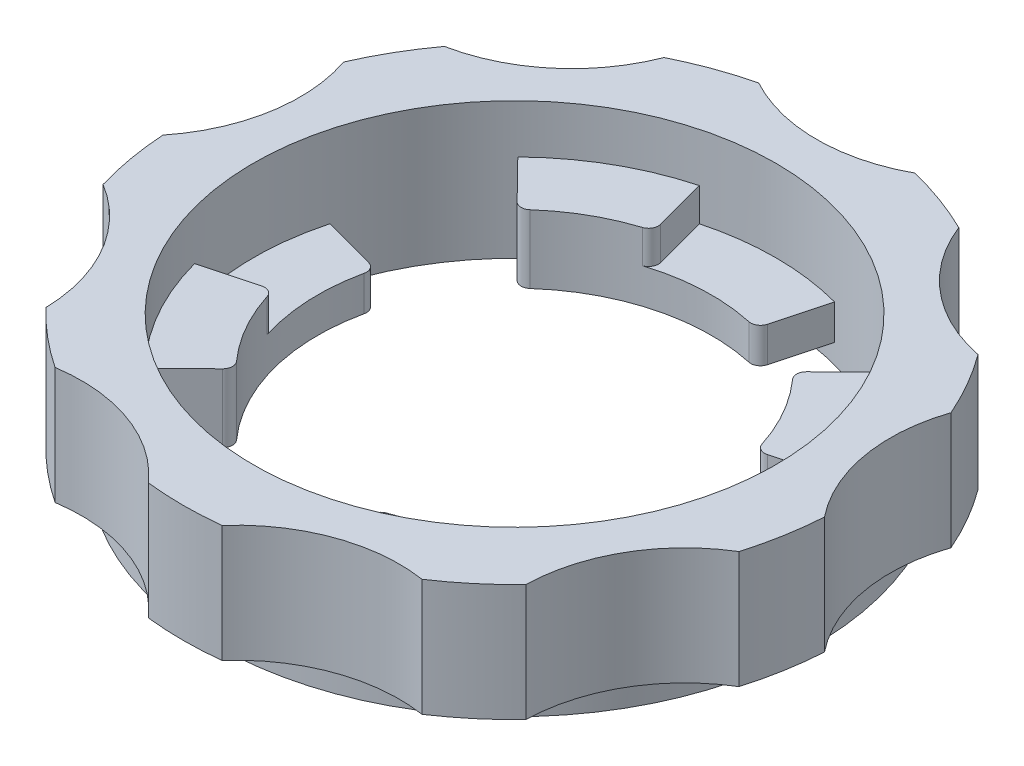
from build123d import *
from build123d.topology import SkipClean

# Parameters (mm, degrees)
EXTRUDE_1_DEPTH                  = 3
SKETCH_3_R                       = 15.4
EXTRUDE_2_DEPTH                  = 1
SKETCH_4_R                       = 13.4
CUT_EXTRUDE_1_DEPTH              = 68.538877693
EXTRUDE_3_DEPTH                  = 3.5
CUT_EXTRUDE_START                = -1.7
CUT_EXTRUDE_2_DEPTH              = 1.7
FILLET_1_R                       = 0.5
PATTERN_CIRCULAR_1_COUNT         = 4
FILLET_1_OF_PATTERN_CIRCULAR_1_R = 0.5
HOLE_WIZARD_M2_1_D               = 2.4
HOLE_WIZARD_M2_1_CBORE_D         = 5
HOLE_WIZARD_M2_1_CBORE_DEPTH     = 1.6
HOLE_WIZARD_M2_2_D               = 2.4
HOLE_WIZARD_M2_2_CBORE_D         = 5
HOLE_WIZARD_M2_2_CBORE_DEPTH     = 1.6
HOLE_WIZARD_M2_1_2_D             = 1.6
FILLET_2_R                       = 3
CUT_EXTRUDE_START_2              = -1.6
SKETCH_15_R                      = 2.5
CUT_EXTRUDE_4_DEPTH              = 1.6
SKETCH_16_W                      = 105
SKETCH_16_H                      = 105
SKETCH_16_R                      = 17
CUT_EXTRUDE_5_DEPTH              = 68.44256816
SKETCH_17_R                      = 8.333697596
CUT_EXTRUDE_6_DEPTH              = 10
PATTERN_CIRCULAR_2_COUNT         = 9


with BuildPart() as part:
    # ｽｹｯﾁ2 → ﾎﾞｽ - 押し出し1 (new, symmetric)
    with BuildSketch(Plane(origin=(0, 0, 0), x_dir=(1, 0, 0), z_dir=(0, 1, 0))):
        with BuildLine():
            ThreePointArc((-13.5, 23.382685902), (-18.457166085, 19.706167058), (-22.449944321, 15))
            Line((-22.449944321, 15), (-13.5, 15))
            Line((-13.5, 15), (-13.5, 23.382685902))
        make_face()
        with BuildLine():
            Line((13.5, 15), (22.449944321, 15))
            ThreePointArc((22.449944321, 15), (18.457166085, 19.706167058), (13.5, 23.382685902))
            Line((13.5, 23.382685902), (13.5, 15))
        make_face()
        with BuildLine():
            Line((-47.5, 0), (-27, 0))
            ThreePointArc((-27, 0), (0, -27), (27, 0))
            Line((27, 0), (47.5, 0))
            Line((47.5, 0), (47.5, 15))
            Line((47.5, 15), (22.449944321, 15))
            Line((22.449944321, 15), (13.5, 15))
            Line((13.5, 15), (13.5, 23.382685902))
            ThreePointArc((13.5, 23.382685902), (0, 27), (-13.5, 23.382685902))
            Line((-13.5, 23.382685902), (-13.5, 15))
            Line((-13.5, 15), (-22.449944321, 15))
            Line((-22.449944321, 15), (-47.5, 15))
            Line((-47.5, 15), (-47.5, 0))
        make_face()
        with BuildLine():
            Line((-13.5, 47.5), (-13.5, 23.382685902))
            ThreePointArc((-13.5, 23.382685902), (0, 27), (13.5, 23.382685902))
            Line((13.5, 23.382685902), (13.5, 47.5))
            Line((13.5, 47.5), (-13.5, 47.5))
        make_face()
    extrude(amount=EXTRUDE_1_DEPTH, both=True)

    # ｽｹｯﾁ3 → ﾎﾞｽ - 押し出し2 (add)
    with BuildSketch(Plane.XZ.offset(3)):
        with Locations(Location((0, 0, 0), (0, 0, 90))):
            Circle(SKETCH_3_R)
    extrude(amount=EXTRUDE_2_DEPTH)

    # ｽｹｯﾁ4 → ｶｯﾄ - 押し出し1 (cut, through all)
    with BuildSketch(Plane.XZ.offset(4)):
        with Locations(Location((0, 0, 0), (0, 0, 270))):
            Circle(SKETCH_4_R)
    extrude(amount=-CUT_EXTRUDE_1_DEPTH, mode=Mode.SUBTRACT)

    # ｽｹｯﾁ5 → ﾎﾞｽ - 押し出し3 (add)
    with BuildSketch(Plane.XZ.offset(3)):
        with BuildLine():
            Line((-7.079183569, -7.203829536), (-9.392184142, -9.557556019))
            ThreePointArc((-9.392184142, -9.557556019), (-3.411666106, -12.958415581), (3.468175204, -12.943406072))
            Line((3.468175204, -12.943406072), (2.614072356, -9.755850846))
            ThreePointArc((2.614072356, -9.755850846), (-2.571479677, -9.767163983), (-7.079183569, -7.203829536))
        make_face()
    extrude_3 = extrude(amount=-EXTRUDE_3_DEPTH)

    # ｽｹｯﾁ6 → ｶｯﾄ - 押し出し2 (cut)
    with SkipClean():  # the faces are left unmerged after this step: merging them gives an invalid solid
        with BuildSketch(Plane(origin=(0, 0.5, 0), x_dir=(1, 0, 0), z_dir=(0, 1, 0)).offset(CUT_EXTRUDE_START)):
            with BuildLine():
                Line((-3.468175204, 12.943406072), (0, 0))
                Line((0, 0), (3.468175204, 12.943406072))
                ThreePointArc((3.468175204, 12.943406072), (0, 13.4), (-3.468175204, 12.943406072))
            make_face()
        cut_extrude_2 = extrude(amount=CUT_EXTRUDE_2_DEPTH, mode=Mode.SUBTRACT)

    # ﾌｨﾚｯﾄ1
    fillet_1_edges = [part.edges().sort_by_distance(p)[0] for p in [
        (-7.079183569, -1.25, -7.203829536),
        (2.614072356, -2.1, -9.755850846),
        (-2.614072356, -0.35, -9.755850846),
    ]]
    fillet(fillet_1_edges, radius=FILLET_1_R)

    # 円形ﾊﾟﾀｰﾝ1: ﾎﾞｽ - 押し出し3, ｶｯﾄ - 押し出し2 ×4 about axis
    with SkipClean():  # the faces are left unmerged after this step: merging them gives an invalid solid
        pattern_circular_1_axis = Axis((0, 0, 0), (0, 1, 0))
        add([extrude_3.rotate(pattern_circular_1_axis, i * 360 / PATTERN_CIRCULAR_1_COUNT) for i in range(1, PATTERN_CIRCULAR_1_COUNT)])
        add([cut_extrude_2.rotate(pattern_circular_1_axis, i * 360 / PATTERN_CIRCULAR_1_COUNT) for i in range(1, PATTERN_CIRCULAR_1_COUNT)], mode=Mode.SUBTRACT)

    # ﾌｨﾚｯﾄ1 of 円形ﾊﾟﾀｰﾝ1
    fillet_1_of_pattern_circular_1_edges = [part.edges().sort_by_distance(p)[0] for p in [
        (-7.203829536, -1.25, 7.079183569),
        (-9.755850846, -2.1, -2.614072356),
        (-9.755850846, -0.35, 2.614072356),
        (7.079183569, -1.25, 7.203829536),
        (-2.614072356, -2.1, 9.755850846),
        (2.614072356, -0.35, 9.755850846),
        (7.203829536, -1.25, -7.079183569),
        (9.755850846, -2.1, 2.614072356),
        (9.755850846, -0.35, -2.614072356),
    ]]
    fillet(fillet_1_of_pattern_circular_1_edges, radius=FILLET_1_OF_PATTERN_CIRCULAR_1_R)

    # Hole Wizard M2 _1 (through all)
    with Locations(Plane(origin=(0, 3, 0), x_dir=(1, 0, 0), z_dir=(0, 1, 0))):
        with Locations((-10.5, -22.5), (-22.5, -10.5)):
            hole_wizard_m2_1 = CounterBoreHole(HOLE_WIZARD_M2_1_D / 2, HOLE_WIZARD_M2_1_CBORE_D / 2, HOLE_WIZARD_M2_1_CBORE_DEPTH)

    # M2 なべ頭ねじ用座ぐり穴2 (through all)
    with Locations(Plane(origin=(0, -3, 0), x_dir=(-1, 0, 0), z_dir=(0, -1, 0))):
        with Locations((10.5, 21), (10.5, 42), (22.5, 10.5)):
            hole_wizard_m2_2 = CounterBoreHole(HOLE_WIZARD_M2_2_D / 2, HOLE_WIZARD_M2_2_CBORE_D / 2, HOLE_WIZARD_M2_2_CBORE_DEPTH)

    # Hole Wizard M2 _1 2 (through all)
    with Locations(Plane(origin=(0, -3, 0), x_dir=(-1, 0, 0), z_dir=(0, -1, 0))):
        with Locations((43.5, 12), (10.5, 43.5)):
            hole_wizard_m2_1_2 = Hole(HOLE_WIZARD_M2_1_2_D / 2)

    # ﾐﾗｰ1: Hole Wizard M2 _1, M2 なべ頭ねじ用座ぐり穴2, Hole Wizard M2 _1 2 across plane
    with SkipClean():  # the faces are left unmerged after this step: merging them gives an invalid solid
        add(hole_wizard_m2_1.mirror(Plane(origin=(0, 0, 0), x_dir=(0, 0, 1), z_dir=(1, 0, 0))), mode=Mode.SUBTRACT)
        add(hole_wizard_m2_2.mirror(Plane(origin=(0, 0, 0), x_dir=(0, 0, 1), z_dir=(1, 0, 0))), mode=Mode.SUBTRACT)
        add(hole_wizard_m2_1_2.mirror(Plane(origin=(0, 0, 0), x_dir=(0, 0, 1), z_dir=(1, 0, 0))), mode=Mode.SUBTRACT)

    # ﾌｨﾚｯﾄ2
    fillet_2_edges = [part.edges().sort_by_distance(p)[0] for p in [
        (47.5, 0, -15),
        (47.5, 0, 0),
        (27, 0, 0),
        (-27, 0, 0),
        (-47.5, 0, 0),
        (-47.5, 0, -15),
        (-22.449944321, 0, -15),
        (-13.5, 0, -23.382685902),
        (-13.5, 0, -47.5),
        (13.5, 0, -47.5),
        (13.5, 0, -23.382685902),
        (22.449944321, 0, -15),
    ]]
    fillet(fillet_2_edges, radius=FILLET_2_R)

    # ｽｹｯﾁ15 → ｶｯﾄ - 押し出し4 (cut)
    with SkipClean():  # the faces are left unmerged after this step: merging them gives an invalid solid
        with BuildSketch(Plane.XZ.offset(3).offset(CUT_EXTRUDE_START_2)):
            with Locations((-22.5, 10.5)):
                Circle(SKETCH_15_R)
            with Locations((22.5, 10.5)):
                Circle(SKETCH_15_R)
        extrude(amount=CUT_EXTRUDE_4_DEPTH, mode=Mode.SUBTRACT)

    # ｽｹｯﾁ16 → ｶｯﾄ - 押し出し5 (cut, through all)
    with SkipClean():  # the faces are left unmerged after this step: merging them gives an invalid solid
        with BuildSketch(Plane.XZ.offset(3)):
            Rectangle(SKETCH_16_W, SKETCH_16_H)
            with Locations(Location((0, 0, 0), (0, 0, 270))):
                Circle(SKETCH_16_R, mode=Mode.SUBTRACT)
        extrude(amount=-CUT_EXTRUDE_5_DEPTH, mode=Mode.SUBTRACT)

    # ｽｹｯﾁ17 → ｶｯﾄ - 押し出し6 (cut)
    with SkipClean():  # the faces are left unmerged after this step: merging them gives an invalid solid
        with BuildSketch(Plane(origin=(0, 3, 0), x_dir=(1, 0, 0), z_dir=(0, 1, 0))):
            with Locations((0, 23.833697596)):
                Circle(SKETCH_17_R)
        cut_extrude_6 = extrude(amount=-CUT_EXTRUDE_6_DEPTH, mode=Mode.SUBTRACT)

    # 円形ﾊﾟﾀｰﾝ2: ｶｯﾄ - 押し出し6 ×9 about axis
    with SkipClean():  # the faces are left unmerged after this step: merging them gives an invalid solid
        pattern_circular_2_axis = Axis((0, 0, 0), (0, 1, 0))
        for i in range(1, PATTERN_CIRCULAR_2_COUNT):
            add(cut_extrude_6.rotate(pattern_circular_2_axis, i * 360 / PATTERN_CIRCULAR_2_COUNT), mode=Mode.SUBTRACT)


solid = part.part
